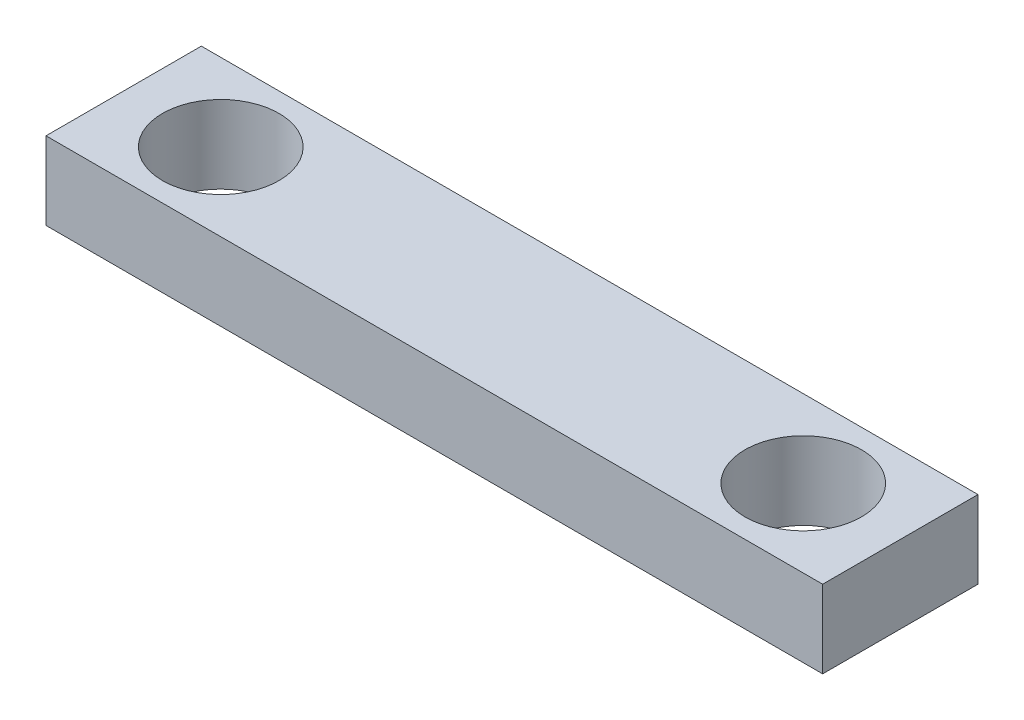
from build123d import *

# Parameters (mm, degrees)
SKETCH_1_W      = 20
SKETCH_1_H      = 4
SKETCH_1_R      = 1.5
EXTRUDE_1_DEPTH = 2


with BuildPart() as part:
    # 草图1 → 凸台-拉伸1 (new body)
    with BuildSketch(Plane(origin=(0, 0, 0), x_dir=(1, 0, 0), z_dir=(0, 1, 0))):
        Rectangle(SKETCH_1_W, SKETCH_1_H)
        with Locations(Location((-7.5, 0, 0), (0, 0, 270))):
            Circle(SKETCH_1_R, mode=Mode.SUBTRACT)
        with Locations(Location((7.5, 0, 0), (0, 0, 270))):
            Circle(SKETCH_1_R, mode=Mode.SUBTRACT)
    extrude(amount=EXTRUDE_1_DEPTH)


solid = part.part
